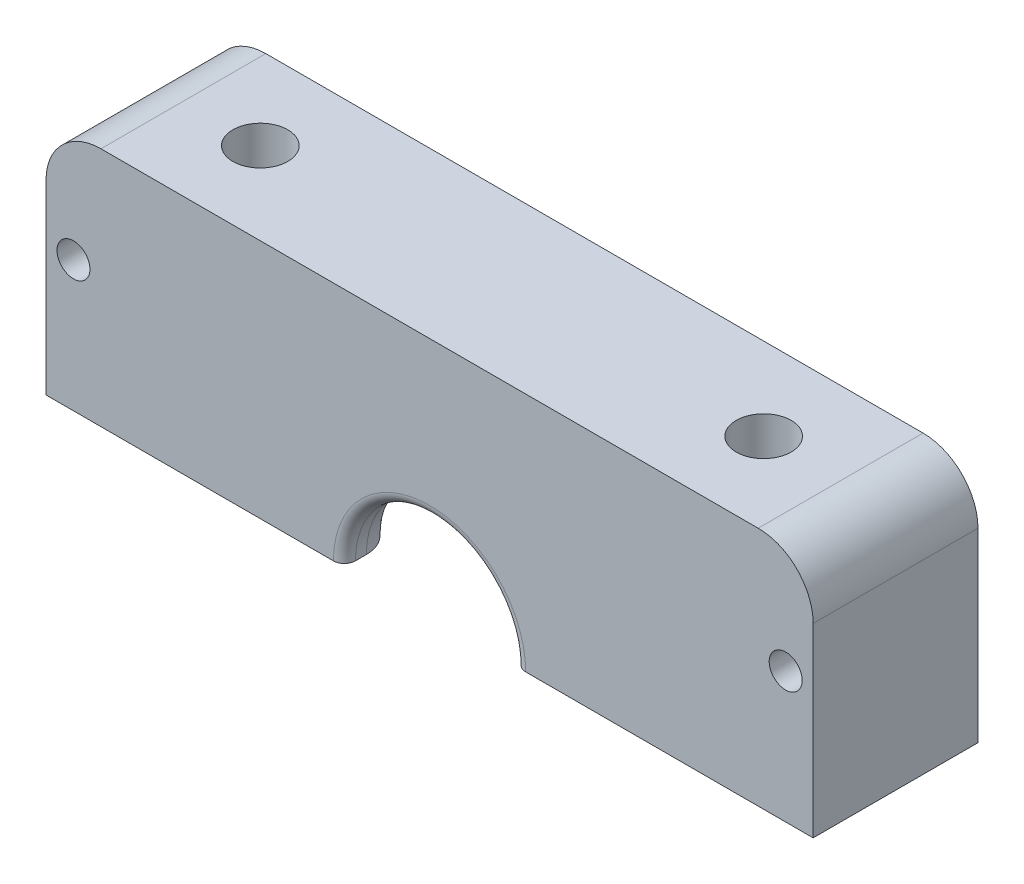
from build123d import *

# Parameters (mm, degrees)
EXTRUDE_1_DEPTH     = 15
SKETCH_2_R          = 1.5
CUT_EXTRUDE_1_DEPTH = 44.847690931
SKETCH_3_R          = 7.75
CUT_EXTRUDE_2_DEPTH = 5
SKETCH_4_W          = 15.5
SKETCH_4_H          = 5.5
SKETCH_5_W          = 88.652710044
SKETCH_5_H          = 26.513310491
CUT_EXTRUDE_3_DEPTH = 44.847690931
SKETCH_6_R          = 2.5
CUT_EXTRUDE_4_DEPTH = 44.847690931
FILLET_3_R          = 1
FILLET_4_R          = 1
FILLET_5_R          = 3


with BuildPart() as part:
    # 草圖1 → 填料-伸長1 (new body)
    with BuildSketch(Plane.XY):
        with BuildLine():
            Line((-29.9, 21.9), (29.9, 21.9))
            ThreePointArc((29.9, 21.9), (33.435533906, 20.435533906), (34.9, 16.9))
            Line((34.9, 16.9), (34.9, -16.9))
            ThreePointArc((34.9, -16.9), (33.435533906, -20.435533906), (29.9, -21.9))
            Line((29.9, -21.9), (-29.9, -21.9))
            ThreePointArc((-29.9, -21.9), (-33.435533906, -20.435533906), (-34.9, -16.9))
            Line((-34.9, -16.9), (-34.9, 16.9))
            ThreePointArc((-34.9, 16.9), (-33.435533906, 20.435533906), (-29.9, 21.9))
        make_face()
    extrude(amount=EXTRUDE_1_DEPTH)

    # 草圖2 → 除料-伸長1 (cut, through all)
    with BuildSketch(Plane.XY.offset(15)):
        with Locations((-32.4, 11.9)):
            Circle(SKETCH_2_R)
        with Locations(Location((-32.4, -11.9, 0), (0, 0, 180))):
            Circle(SKETCH_2_R)
        with Locations((32.4, -11.9)):
            Circle(SKETCH_2_R)
        with Locations(Location((32.4, 11.9, 0), (0, 0, 180))):
            Circle(SKETCH_2_R)
    extrude(amount=-CUT_EXTRUDE_1_DEPTH, mode=Mode.SUBTRACT)

    # 草圖3 → 除料-伸長2 (cut)
    with BuildSketch(Plane.XY.offset(15)):
        Circle(SKETCH_3_R)
    extrude(amount=-CUT_EXTRUDE_2_DEPTH, mode=Mode.SUBTRACT)

    # 草圖4 → 除料-旋轉1 (revolve, cut)
    with BuildSketch(Plane(origin=(0, 0, 0), x_dir=(1, 0, 0), z_dir=(0, 1, 0)), mode=Mode.PRIVATE) as cut_revolve_1_sk:
        with Locations((-7.75, -7.25)):
            Rectangle(SKETCH_4_W, SKETCH_4_H)
    revolve(cut_revolve_1_sk.sketch.rotate(Axis((0, 0, 15), (0, 0, -1)), 180), axis=Axis((0, 0, 15), (0, 0, -1)), mode=Mode.SUBTRACT)

    # 草圖5 → 除料-伸長3 (cut, through all)
    with BuildSketch(Plane.XY.offset(15)):
        with Locations((0.900027513, -13.256655246)):
            Rectangle(SKETCH_5_W, SKETCH_5_H)
    extrude(amount=-CUT_EXTRUDE_3_DEPTH, mode=Mode.SUBTRACT)

    # 草圖6 → 除料-伸長4 (cut, through all)
    with BuildSketch(Plane(origin=(0, 21.9, 0), x_dir=(1, 0, 0), z_dir=(0, 1, 0))):
        with Locations(Location((-22.9, -7.5, 0), (0, 0, 270))):
            Circle(SKETCH_6_R)
        with Locations(Location((22.9, -7.5, 0), (0, 0, 90))):
            Circle(SKETCH_6_R)
    extrude(amount=-CUT_EXTRUDE_4_DEPTH, mode=Mode.SUBTRACT)

    # 圓角3
    fillet_3_edges = [part.edges().sort_by_distance(p)[0] for p in [
        (0, 15.5, 10),
        (0, 15.5, 4.5),
    ]]
    fillet(fillet_3_edges, radius=FILLET_3_R)

    # 圓角4
    fillet_4_edges = [part.edges().sort_by_distance(p)[0] for p in [
        (0, 7.75, 15),
    ]]
    fillet(fillet_4_edges, radius=FILLET_4_R)

    # 圓角5
    fillet_5_edges = [part.edges().sort_by_distance(p)[0] for p in [
        (0, 7.75, 10),
    ]]
    fillet(fillet_5_edges, radius=FILLET_5_R)


solid = part.part
